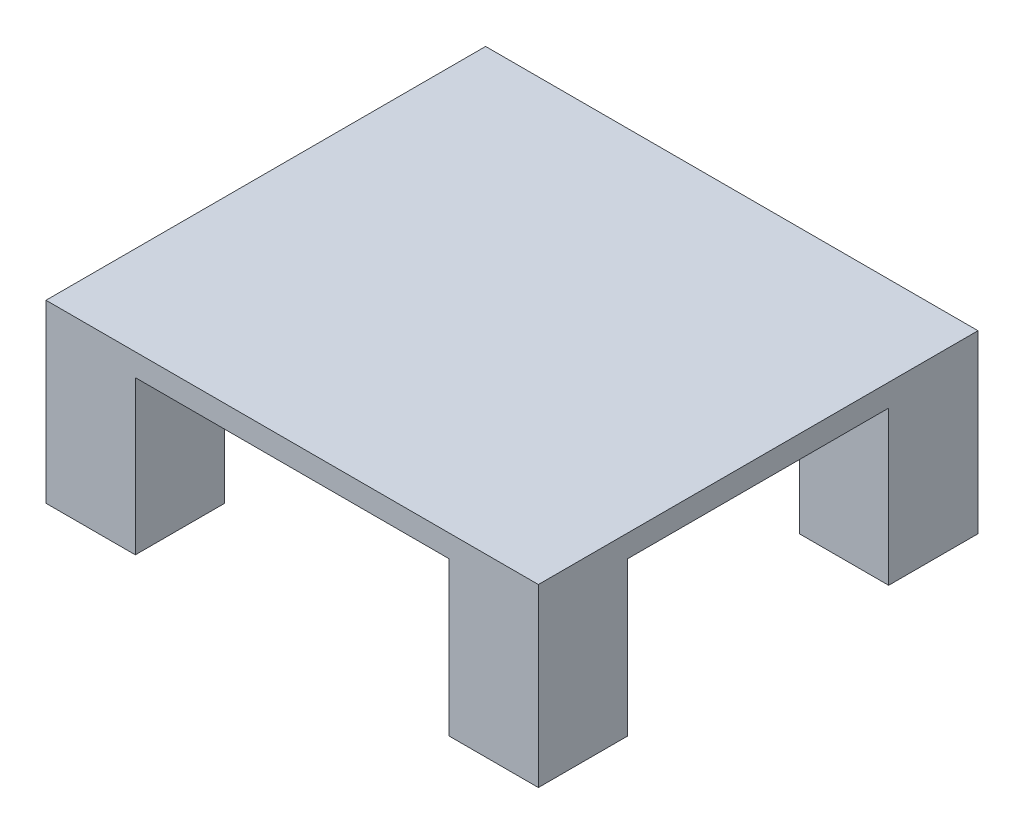
from build123d import *

# Parameters (mm, degrees)
CROQUIS1_W                = 50.8
CROQUIS1_H                = 50.8
SALIENTE_EXTRUIR1_DEPTH   = 100
SALIENTE_EXTRUIR1_2_DEPTH = 100
SALIENTE_EXTRUIR1_3_DEPTH = 100
SALIENTE_EXTRUIR1_4_DEPTH = 100
SALIENTE_EXTRUIR2_REACH   = 390.458
CROQUIS2_W                = 280
CROQUIS2_H                = 12.7


with BuildPart() as part:
    # Croquis1 → Saliente-Extruir1 (new body)
    with BuildSketch(Plane(origin=(0, 0, 0), x_dir=(1, 0, 0), z_dir=(0, 1, 0))):
        with Locations((25.4, -25.4)):
            Rectangle(CROQUIS1_W, CROQUIS1_H)
    extrude(amount=SALIENTE_EXTRUIR1_DEPTH)


with BuildPart() as body_2:
    # Croquis1 → Saliente-Extruir1 2 (new body)
    with BuildSketch(Plane(origin=(0, 0, 0), x_dir=(1, 0, 0), z_dir=(0, 1, 0))):
        with Locations((254.6, -25.4)):
            Rectangle(CROQUIS1_W, CROQUIS1_H)
    extrude(amount=SALIENTE_EXTRUIR1_2_DEPTH)

    # Saliente-Extruir2: up to this face of the body (flat: up to its plane)
    saliente_extruir2_end = Plane(body_2.part.faces().sort_by_distance((254.6, 50, 0))[0])
    # Croquis2 → Saliente-Extruir2 (add, up to the picked face)
    with BuildSketch(Plane.XY.offset(250), mode=Mode.PRIVATE) as saliente_extruir2_sk1:
        with Locations((140, 93.65)):
            Rectangle(CROQUIS2_W, CROQUIS2_H)
    saliente_extruir2_tool1 = split(extrude(saliente_extruir2_sk1.sketch, amount=-SALIENTE_EXTRUIR2_REACH, mode=Mode.PRIVATE), bisect_by=saliente_extruir2_end, keep=Keep.BOTH, mode=Mode.PRIVATE)

    add(part.part)  # Saliente-Extruir2 merges part


with BuildPart() as body_3:
    # Croquis1 → Saliente-Extruir1 3 (new body)
    with BuildSketch(Plane(origin=(0, 0, 0), x_dir=(1, 0, 0), z_dir=(0, 1, 0))):
        with Locations((254.6, -224.6)):
            Rectangle(CROQUIS1_W, CROQUIS1_H)
    extrude(amount=SALIENTE_EXTRUIR1_3_DEPTH)


with BuildPart() as body_4:
    # Croquis1 → Saliente-Extruir1 4 (new body)
    with BuildSketch(Plane(origin=(0, 0, 0), x_dir=(1, 0, 0), z_dir=(0, 1, 0))):
        with Locations((25.4, -224.6)):
            Rectangle(CROQUIS1_W, CROQUIS1_H)
    extrude(amount=SALIENTE_EXTRUIR1_4_DEPTH)


with BuildPart() as body_2_1:
    add(body_2.part)

    add(body_3.part)  # Saliente-Extruir2 merges body 3

    add(body_4.part)  # Saliente-Extruir2 merges body 4
    add(saliente_extruir2_tool1.solids().sort_by(Axis((140, 93.65, 250), (0, 0, -1)))[0])


solid = body_2_1.part
